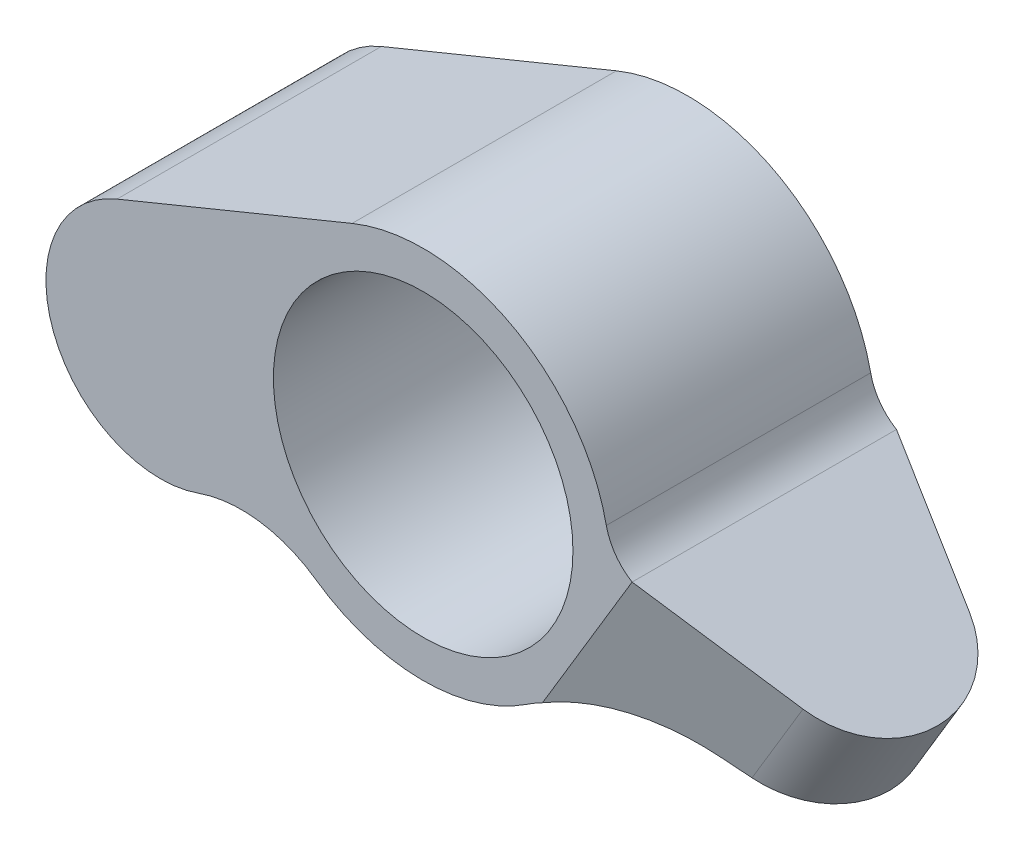
from build123d import *

# Parameters (mm, degrees)
CROQUIS1_R              = 17
SALIENTE_EXTRUIR1_DEPTH = 30
CORTAR_EXTRUIR5_DEPTH   = 66.901748436


with BuildPart() as part:
    # Croquis1 → Saliente-Extruir1 (new body)
    with BuildSketch(Plane.XY):
        with BuildLine():
            Line((-34.751366554, 8.708761257), (-8.067498219, 19.65904302))
            ThreePointArc((-8.067498219, 19.65904302), (9.932956283, 18.785602984), (20.78928746, 4.400912053))
            ThreePointArc((20.78928746, 4.400912053), (21.824692428, 2.04462752), (23.714959375, 0.297907417))
            Line((23.714959375, 0.297907417), (43.380202362, -11.504419481))
            Line((43.380202362, -11.504419481), (37.980772654, -20.60816348))
            Line((37.980772654, -20.60816348), (29.126956343, -16.414809963))
            ThreePointArc((29.126956343, -16.414809963), (20.290915471, -14.763720087), (11.788304563, -17.680451791))
            ThreePointArc((11.788304563, -17.680451791), (-0.239292664, -21.24865264), (-12.18348282, -17.410492422))
            ThreePointArc((-12.18348282, -17.410492422), (-18.624029112, -14.886802036), (-25.506269787, -15.582799871))
            ThreePointArc((-25.506269787, -15.582799871), (-41.965765273, -7.942029126), (-34.751366554, 8.708761257))
        make_face()
        Circle(CROQUIS1_R, mode=Mode.SUBTRACT)
    extrude(amount=SALIENTE_EXTRUIR1_DEPTH)

    # Croquis7 → Cortar-Extruir5 (cut, through all)
    with BuildSketch(Plane(origin=(6.411424524, 10.682827398, 0), x_dir=(0.857431728196329, -0.5145977375409424, 0), z_dir=(0.5145977375409424, 0.857431728196329, 0))):
        with BuildLine():
            Line((20.180656118, 0), (20.180656118, 9.238458875))
            Line((20.180656118, 9.238458875), (56.582580984, 4.619229438))
            Line((56.582580984, 4.619229438), (52.496685568, -37.874416839))
            Line((52.496685568, -37.874416839), (21.89416276, -35.456233837))
            Line((21.89416276, -35.456233837), (20.180656118, -30))
            Line((20.180656118, -30), (36.352428356, -24.467854313))
            ThreePointArc((36.352428356, -24.467854313), (43.115709537, -15.009568923), (36.358878018, -5.546674933))
            Line((36.358878018, -5.546674933), (20.180656118, 0))
        make_face()
    extrude(amount=-CORTAR_EXTRUIR5_DEPTH, mode=Mode.SUBTRACT)


solid = part.part
